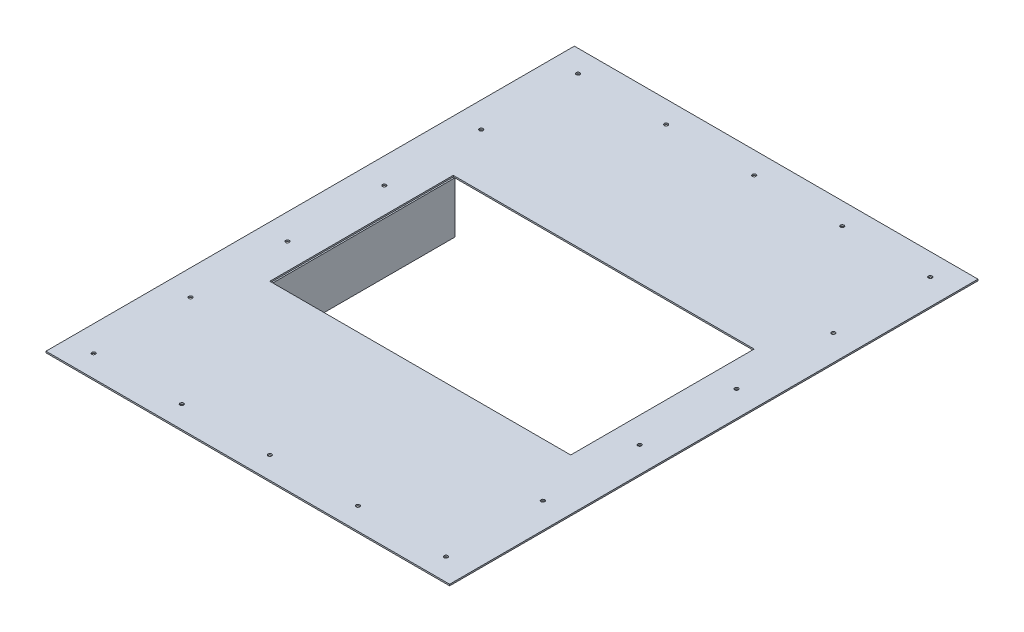
from build123d import *

# Parameters (mm, degrees)
SKETCH3_W           = 550
SKETCH3_H           = 720
SKETCH3_R           = 2.5
SKETCH3_W_2         = 410
SKETCH3_H_2         = 250
BOSS_EXTRUDE2_DEPTH = 2
SKETCH5_W           = 250
SKETCH5_H           = 70
BOSS_EXTRUDE3_DEPTH = 2
SKETCH6_W           = 250
SKETCH6_H           = 70
BOSS_EXTRUDE4_DEPTH = 2


with BuildPart() as part:
    # Sketch3 → Boss-Extrude2 (new body)
    with BuildSketch(Plane(origin=(0, 0, 0), x_dir=(1, 0, 0), z_dir=(0, 1, 0))):
        with Locations((275, -360)):
            Rectangle(SKETCH3_W, SKETCH3_H)
        with Locations(Location((35, -30, 0), (0, 0, 270))):
            Circle(SKETCH3_R, mode=Mode.SUBTRACT)
        with Locations(Location((35, -162, 0), (0, 0, 270))):
            Circle(SKETCH3_R, mode=Mode.SUBTRACT)
        with Locations(Location((35, -294, 0), (0, 0, 270))):
            Circle(SKETCH3_R, mode=Mode.SUBTRACT)
        with Locations(Location((35, -426, 0), (0, 0, 270))):
            Circle(SKETCH3_R, mode=Mode.SUBTRACT)
        with Locations(Location((35, -558, 0), (0, 0, 270))):
            Circle(SKETCH3_R, mode=Mode.SUBTRACT)
        with Locations(Location((35, -690, 0), (0, 0, 270))):
            Circle(SKETCH3_R, mode=Mode.SUBTRACT)
        with Locations(Location((275, -30, 0), (0, 0, 270))):
            Circle(SKETCH3_R, mode=Mode.SUBTRACT)
        with Locations(Location((155, -30, 0), (0, 0, 270))):
            Circle(SKETCH3_R, mode=Mode.SUBTRACT)
        with Locations(Location((395, -30, 0), (0, 0, 270))):
            Circle(SKETCH3_R, mode=Mode.SUBTRACT)
        with Locations(Location((155, -690, 0), (0, 0, 270))):
            Circle(SKETCH3_R, mode=Mode.SUBTRACT)
        with Locations(Location((275, -690, 0), (0, 0, 270))):
            Circle(SKETCH3_R, mode=Mode.SUBTRACT)
        with Locations(Location((395, -690, 0), (0, 0, 270))):
            Circle(SKETCH3_R, mode=Mode.SUBTRACT)
        with Locations(Location((515, -690, 0), (0, 0, 270))):
            Circle(SKETCH3_R, mode=Mode.SUBTRACT)
        with Locations(Location((515, -558, 0), (0, 0, 270))):
            Circle(SKETCH3_R, mode=Mode.SUBTRACT)
        with Locations(Location((515, -426, 0), (0, 0, 270))):
            Circle(SKETCH3_R, mode=Mode.SUBTRACT)
        with Locations(Location((515, -294, 0), (0, 0, 270))):
            Circle(SKETCH3_R, mode=Mode.SUBTRACT)
        with Locations(Location((515, -162, 0), (0, 0, 270))):
            Circle(SKETCH3_R, mode=Mode.SUBTRACT)
        with Locations(Location((515, -30, 0), (0, 0, 270))):
            Circle(SKETCH3_R, mode=Mode.SUBTRACT)
        with Locations((275, -360)):
            Rectangle(SKETCH3_W_2, SKETCH3_H_2, mode=Mode.SUBTRACT)
    extrude(amount=BOSS_EXTRUDE2_DEPTH)


with BuildPart() as body_2:
    # Sketch5 → Boss-Extrude3 (new body)
    with BuildSketch(Plane(origin=(70, 0, 0), x_dir=(0, 0, -1), z_dir=(1, 0, 0))):
        with Locations((-360, -35)):
            Rectangle(SKETCH5_W, SKETCH5_H)
    extrude(amount=BOSS_EXTRUDE3_DEPTH)


with BuildPart() as body_3:
    # Sketch6 → Boss-Extrude4 (new body)
    with BuildSketch(Plane.ZY.offset(-480)):
        with Locations((360, -35)):
            Rectangle(SKETCH6_W, SKETCH6_H)
    extrude(amount=BOSS_EXTRUDE4_DEPTH)


solid = Compound([part.part, body_2.part, body_3.part])
